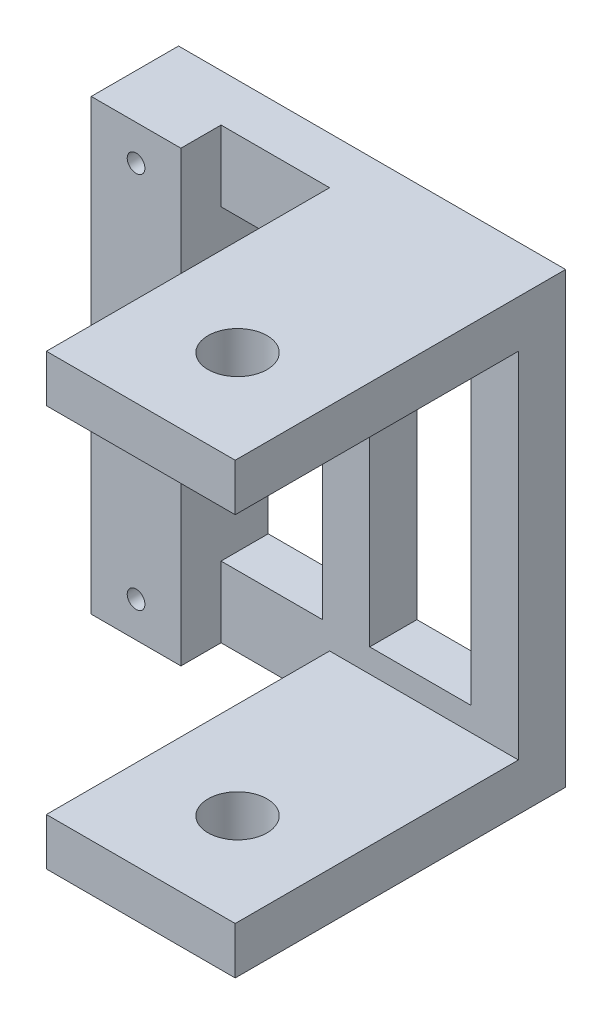
from build123d import *

# Parameters (mm, degrees)
SKETCH_2_W          = 16.4
SKETCH_2_H          = 19
SKETCH_2_W_2        = 4.3
SKETCH_2_H_2        = 13
EXTRUDE_1_DEPTH     = 2
SKETCH_3_W          = 8
SKETCH_3_H          = 2
EXTRUDE_2_DEPTH     = 12
SKETCH_10_W         = 3.8
SKETCH_10_H         = 19
EXTRUDE_4_DEPTH     = 1.7
CUT_EXTRUDE_START   = 1.7
SKETCH_9_R          = 0.375
CUT_EXTRUDE_2_DEPTH = 3.7
SKETCH_11_R         = 1.25
CUT_EXTRUDE_3_DEPTH = 26.294465798


with BuildPart() as part:
    # 草图2 → 凸台-拉伸1 (new body)
    with BuildSketch(Plane.XY):
        with Locations((-0.9, 0)):
            Rectangle(SKETCH_2_W, SKETCH_2_H)
        with Locations((-3.15, 0)):
            Rectangle(SKETCH_2_W_2, SKETCH_2_H_2, mode=Mode.SUBTRACT)
        with Locations((3.15, 0)):
            Rectangle(SKETCH_2_W_2, SKETCH_2_H_2, mode=Mode.SUBTRACT)
    extrude(amount=EXTRUDE_1_DEPTH)

    # 草图3 → 凸台-拉伸2 (add)
    with BuildSketch(Plane.XY.offset(2)):
        with Locations((3.3, 8.5)):
            Rectangle(SKETCH_3_W, SKETCH_3_H)
        with Locations((3.3, -8.5)):
            Rectangle(SKETCH_3_W, SKETCH_3_H)
    extrude(amount=EXTRUDE_2_DEPTH)

    # 草图10 → 凸台-拉伸4 (add)
    with BuildSketch(Plane.XY.offset(2)):
        with Locations((-7.2, 0)):
            Rectangle(SKETCH_10_W, SKETCH_10_H)
    extrude(amount=EXTRUDE_4_DEPTH)

    # 草图9 → 切除-拉伸2 (cut)
    with BuildSketch(Plane.XY.offset(2).offset(CUT_EXTRUDE_START)):
        with Locations((-7.2, 8)):
            Circle(SKETCH_9_R)
        with Locations((-7.2, -8)):
            Circle(SKETCH_9_R)
    extrude(amount=-CUT_EXTRUDE_2_DEPTH, mode=Mode.SUBTRACT)

    # 草图11 → 切除-拉伸3 (cut, through all)
    with BuildSketch(Plane.XZ.offset(9.5)):
        with Locations(Location((3.4, 10, 0), (0, 0, 270))):
            Circle(SKETCH_11_R)
    extrude(amount=-CUT_EXTRUDE_3_DEPTH, mode=Mode.SUBTRACT)


solid = part.part
